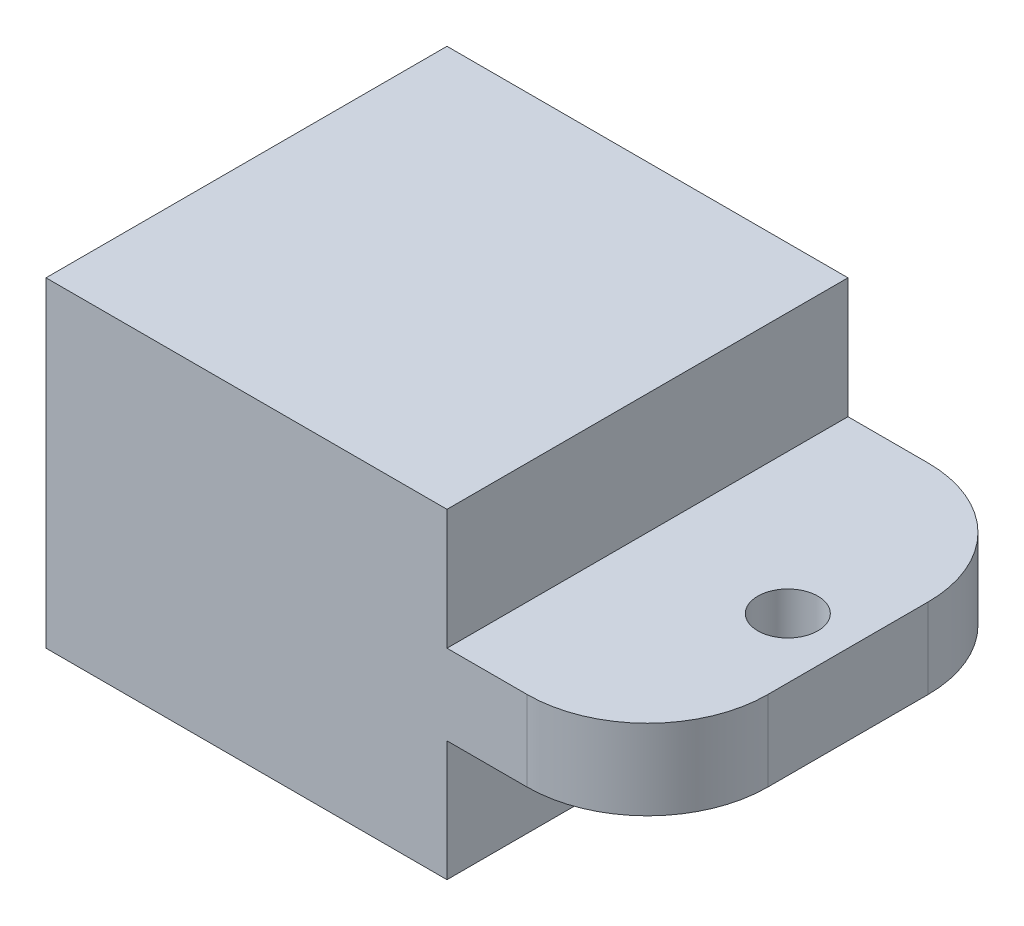
from build123d import *

# Parameters (mm, degrees)
BOSS_EXTRUDE1_DEPTH = 50
SKETCH2_R           = 7.5
CUT_EXTRUDE1_DEPTH  = 104.07764064
FILLET1_R           = 30
FILLET2_R           = 30


with BuildPart() as part:
    # Sketch1 → Boss-Extrude1 (new, symmetric)
    with BuildSketch(Plane.XY):
        Polygon((0, 0), (-75, 0), (-75, 40), (25, 40), (25, 10), (75, 10), (75, 0), align=None)
    boss_extrude1 = extrude(amount=BOSS_EXTRUDE1_DEPTH, both=True)

    # Mirror1: Boss-Extrude1 across plane
    add(boss_extrude1.mirror(Plane(origin=(0, 0, -50), x_dir=(0, 0, 1), z_dir=(0, -1, 0))))

    # Sketch2 → Cut-Extrude1 (cut, through all)
    with BuildSketch(Plane(origin=(0, 10, 0), x_dir=(1, 0, 0), z_dir=(0, 1, 0))):
        with Locations((60, 0)):
            Circle(SKETCH2_R)
    extrude(amount=-CUT_EXTRUDE1_DEPTH, mode=Mode.SUBTRACT)

    # Fillet1
    fillet1_edges = [part.edges().sort_by_distance(p)[0] for p in [
        (75, 0, -50),
    ]]
    fillet(fillet1_edges, radius=FILLET1_R)

    # Fillet2
    fillet2_edges = [part.edges().sort_by_distance(p)[0] for p in [
        (75, 0, 50),
    ]]
    fillet(fillet2_edges, radius=FILLET2_R)


solid = part.part
